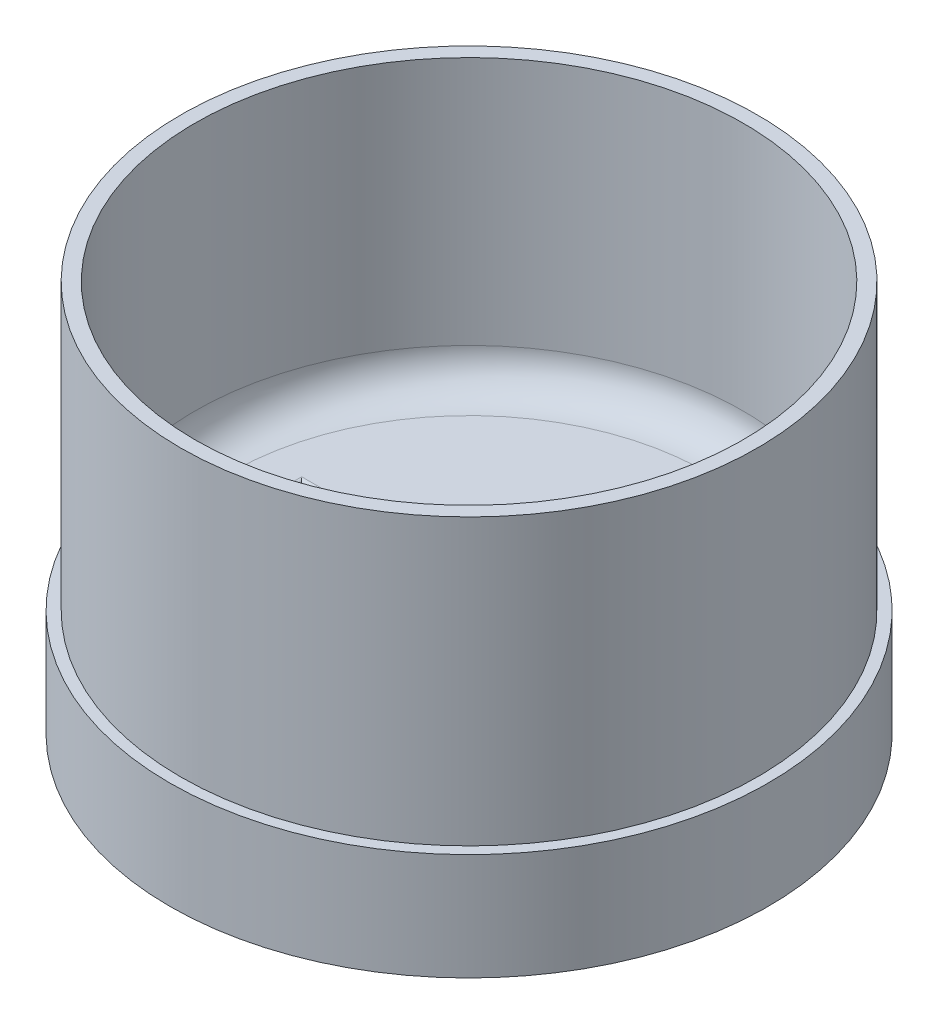
from build123d import *

# Parameters (mm, degrees)
SKETCH1_R           = 84
SKETCH1_R_2         = 79
BOSS_EXTRUDE1_DEPTH = 25
SKETCH2_R           = 84
BOSS_EXTRUDE2_DEPTH = 5
SKETCH3_R           = 81
SKETCH3_R_2         = 77
BOSS_EXTRUDE3_DEPTH = 80
FILLET1_R           = 10
CUT_EXTRUDE1_REACH  = 148.072
SKETCH4_W           = 14
SKETCH4_H           = 7
CUT_EXTRUDE2_REACH  = 145.22
SKETCH5_W           = 10
SKETCH5_H           = 16
FILLET2_R           = 1


with BuildPart() as part:
    # Sketch1 → Boss-Extrude1 (new body)
    with BuildSketch(Plane(origin=(0, 0, 0), x_dir=(1, 0, 0), z_dir=(0, 1, 0))):
        with Locations(Location((0, 0, 0), (0, 0, 270))):
            Circle(SKETCH1_R)
        with Locations(Location((0, 0, 0), (0, 0, 270))):
            Circle(SKETCH1_R_2, mode=Mode.SUBTRACT)
    extrude(amount=BOSS_EXTRUDE1_DEPTH)

    # Sketch2 → Boss-Extrude2 (add)
    with BuildSketch(Plane(origin=(0, 25, 0), x_dir=(1, 0, 0), z_dir=(0, 1, 0))):
        with Locations(Location((0, 0, 0), (0, 0, 270))):
            Circle(SKETCH2_R)
    extrude(amount=BOSS_EXTRUDE2_DEPTH)

    # Sketch3 → Boss-Extrude3 (add)
    with BuildSketch(Plane(origin=(0, 30, 0), x_dir=(1, 0, 0), z_dir=(0, 1, 0))):
        with Locations(Location((0, 0, 0), (0, 0, 270))):
            Circle(SKETCH3_R)
        with Locations(Location((0, 0, 0), (0, 0, 270))):
            Circle(SKETCH3_R_2, mode=Mode.SUBTRACT)
    extrude(amount=BOSS_EXTRUDE3_DEPTH)

    # Fillet1
    fillet1_edges = [part.edges().sort_by_distance(p)[0] for p in [
        (0, 25, -79),
        (0, 30, -77),
    ]]
    fillet(fillet1_edges, radius=FILLET1_R)

    # Sketch4 → Cut-Extrude1 (cut, up to next)
    with BuildSketch(Plane.XZ.offset(-25), mode=Mode.PRIVATE) as cut_extrude1_sk1:
        Rectangle(SKETCH4_W, SKETCH4_H)
    cut_extrude1_tool1 = extrude(cut_extrude1_sk1.sketch, amount=-CUT_EXTRUDE1_REACH, mode=Mode.PRIVATE) & part.part
    add(cut_extrude1_tool1.solids().sort_by_distance((0, 25, 0))[0], mode=Mode.SUBTRACT)

    # Sketch5 → Cut-Extrude2 (cut, up to next)
    with BuildSketch(Plane(origin=(0, 30, 0), x_dir=(1, 0, 0), z_dir=(0, 1, 0)), mode=Mode.PRIVATE) as cut_extrude2_sk1:
        with Locations((-50, 0)):
            Rectangle(SKETCH5_W, SKETCH5_H)
    cut_extrude2_tool1 = extrude(cut_extrude2_sk1.sketch, amount=-CUT_EXTRUDE2_REACH, mode=Mode.PRIVATE) & part.part
    add(cut_extrude2_tool1.solids().sort_by_distance((-50, 30, 0))[0], mode=Mode.SUBTRACT)

    # Fillet2
    fillet2_edges = [part.edges().sort_by_distance(p)[0] for p in [
        (0, 30, 3.5),
        (7, 30, 0),
        (0, 30, -3.5),
        (-7, 30, 0),
        (0, 25, 3.5),
        (-7, 25, 0),
        (0, 25, -3.5),
        (7, 25, 0),
        (-55, 30, 0),
        (-50, 30, 8),
        (-45, 30, 0),
        (-50, 30, -8),
        (-50, 25, 8),
        (-55, 25, 0),
        (-50, 25, -8),
        (-45, 25, 0),
    ]]
    fillet(fillet2_edges, radius=FILLET2_R)


solid = part.part
